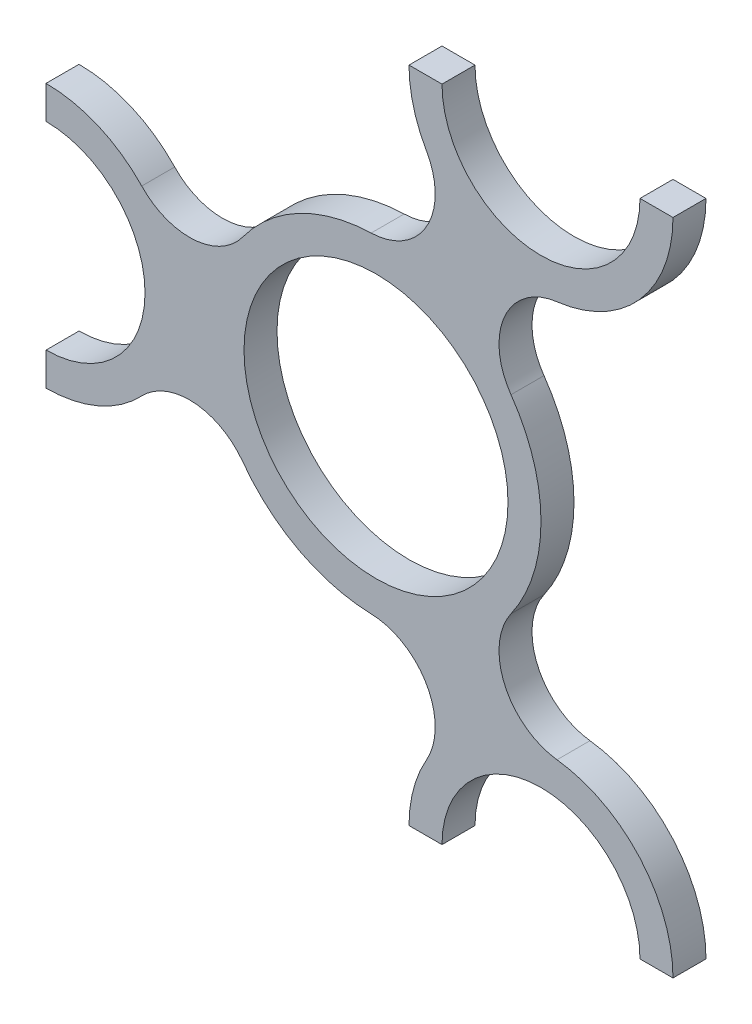
from build123d import *

# Parameters (mm, degrees)
SKETCH2_R           = 40
BOSS_EXTRUDE1_DEPTH = 10


with BuildPart() as part:
    # Sketch2 → Boss-Extrude1 (new body)
    with BuildSketch(Plane.XY):
        with BuildLine():
            Line((-100, -40), (-100, -30))
            ThreePointArc((-100, -30), (-70, 0), (-100, 30))
            Line((-100, 30), (-100, 40))
            ThreePointArc((-100, 40), (-84.220237409, 36.755939555), (-71, 27.549954628))
            ThreePointArc((-71, 27.549954628), (-55.218260111, 21.366045629), (-40.357142857, 29.51780853))
            ThreePointArc((-40.357142857, 29.51780853), (-23.282031855, 44.248694813), (-1.47081146, 49.978362455))
            ThreePointArc((-1.47081146, 49.978362455), (15.390674553, 60.197087002), (15.293909304, 79.913138291))
            ThreePointArc((15.293909304, 79.913138291), (11.346128086, 89.510287366), (10, 99.8))
            Line((10, 99.8), (20, 99.8))
            ThreePointArc((20, 99.8), (50, 69.8), (80, 99.8))
            Line((80, 99.8), (90, 99.8))
            ThreePointArc((90, 99.8), (79.950139168, 73.286057181), (54.85054181, 60.095186134))
            ThreePointArc((54.85054181, 60.095186134), (39.000828287, 48.368352667), (40.911294797, 28.744842286))
            ThreePointArc((40.911294797, 28.744842286), (50, 0), (40.911294797, -28.744842286))
            ThreePointArc((40.911294797, -28.744842286), (39.000828287, -48.368352667), (54.85054181, -60.095186134))
            ThreePointArc((54.85054181, -60.095186134), (79.950139168, -73.286057181), (90, -99.8))
            Line((90, -99.8), (80, -99.8))
            ThreePointArc((80, -99.8), (50, -69.8), (20, -99.8))
            Line((20, -99.8), (10, -99.8))
            ThreePointArc((10, -99.8), (11.346128086, -89.510287366), (15.293909304, -79.913138291))
            ThreePointArc((15.293909304, -79.913138291), (15.390674553, -60.197087002), (-1.47081146, -49.978362455))
            ThreePointArc((-1.47081146, -49.978362455), (-23.282031855, -44.248694813), (-40.357142857, -29.51780853))
            ThreePointArc((-40.357142857, -29.51780853), (-55.218260111, -21.366045629), (-71, -27.549954628))
            ThreePointArc((-71, -27.549954628), (-84.220237409, -36.755939555), (-100, -40))
        make_face()
        Circle(SKETCH2_R, mode=Mode.SUBTRACT)
    extrude(amount=BOSS_EXTRUDE1_DEPTH)


solid = part.part
